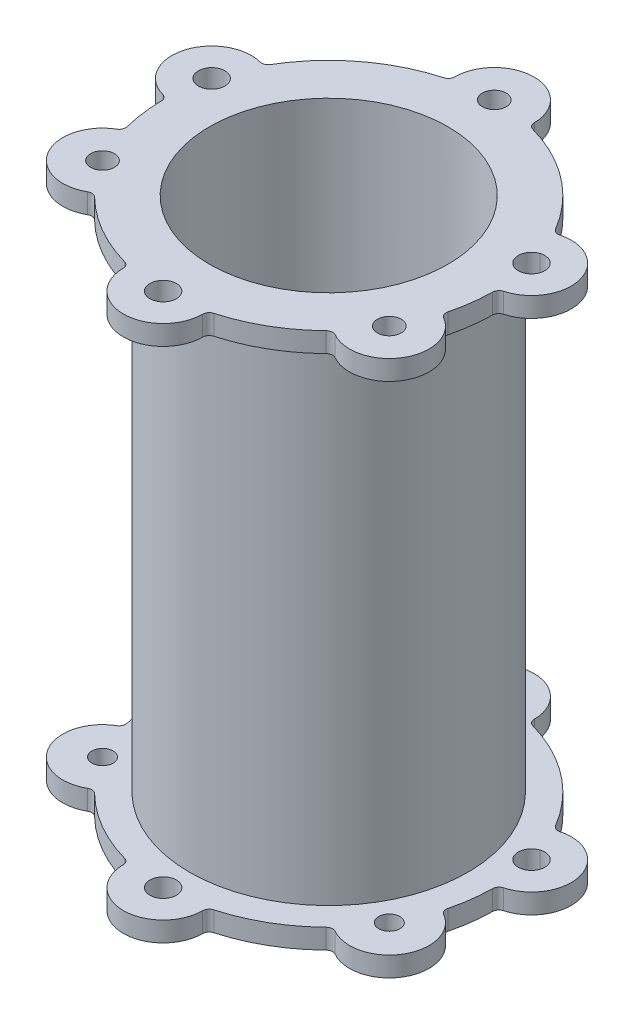
from build123d import *

# Parameters (mm, degrees)
SKETCH1_R             = 10.5
SKETCH1_R_2           = 9
BOSS_EXTRUDE1_DEPTH   = 37.5
SKETCH2_R             = 1
SKETCH2_R_2           = 9
BOSS_EXTRUDE2_DEPTH   = 1.5
FILLET1_R             = 0.5
FILLET1_OF_MIRROR1_R  = 0.5
SKETCH10_R            = 7.65
CUT_EXTRUDE1_DEPTH    = 45.592350079
SKETCH13_R            = 0.9
CUT_EXTRUDE2_DEPTH    = 1.5
M2X0_4_TAPPED_HOLE3_D = 1.6


with BuildPart() as part:
    # Sketch1 → Boss-Extrude1 (new body)
    with BuildSketch(Plane(origin=(0, 0, 0), x_dir=(1, 0, 0), z_dir=(0, 1, 0))):
        with Locations(Location((0, 0, 0), (0, 0, 270))):
            Circle(SKETCH1_R)
        with Locations(Location((0, 0, 0), (0, 0, 270))):
            Circle(SKETCH1_R_2, mode=Mode.SUBTRACT)
    extrude(amount=BOSS_EXTRUDE1_DEPTH)

    # Sketch2 → Boss-Extrude2 (add)
    with BuildSketch(Plane(origin=(0, 37.5, 0), x_dir=(1, 0, 0), z_dir=(0, 1, 0))):
        with BuildLine():
            Line((-3, -12.1346611), (-3, -12.5))
            ThreePointArc((-3, -12.5), (0, -15.5), (3, -12.5))
            Line((3, -12.5), (3, -12.1346611))
            ThreePointArc((3, -12.1346611), (6.25, -10.825317547), (9.008924778, -8.665406761))
            Line((9.008924778, -8.665406761), (9.325317547, -8.848076211))
            ThreePointArc((9.325317547, -8.848076211), (13.423393759, -7.75), (12.325317547, -3.651923789))
            Line((12.325317547, -3.651923789), (12.008924778, -3.469254338))
            ThreePointArc((12.008924778, -3.469254338), (12.393060767, -1.631577403), (12.497639685, 0.24290392))
            Line((12.497639685, 0.24290392), (12.850529964, 0.337460585))
            ThreePointArc((12.850529964, 0.337460585), (14.971850307, 4.011695199), (11.297615693, 6.133015543))
            Line((11.297615693, 6.133015543), (10.944725414, 6.038458877))
            ThreePointArc((10.944725414, 6.038458877), (7.609517863, 9.916916754), (3, 12.1346611))
            Line((3, 12.1346611), (3, 12.5))
            ThreePointArc((3, 12.5), (0, 15.5), (-3, 12.5))
            Line((-3, 12.5), (-3, 12.1346611))
            ThreePointArc((-3, 12.1346611), (-7.609517863, 9.916916754), (-10.944725414, 6.038458877))
            Line((-10.944725414, 6.038458877), (-11.297615693, 6.133015543))
            ThreePointArc((-11.297615693, 6.133015543), (-14.971850307, 4.011695199), (-12.850529964, 0.337460585))
            Line((-12.850529964, 0.337460585), (-12.497639685, 0.24290392))
            ThreePointArc((-12.497639685, 0.24290392), (-12.393060767, -1.631577403), (-12.008924778, -3.469254338))
            Line((-12.008924778, -3.469254338), (-12.325317547, -3.651923789))
            ThreePointArc((-12.325317547, -3.651923789), (-13.423393759, -7.75), (-9.325317547, -8.848076211))
            Line((-9.325317547, -8.848076211), (-9.008924778, -8.665406761))
            ThreePointArc((-9.008924778, -8.665406761), (-6.25, -10.825317547), (-3, -12.1346611))
        make_face()
        with Locations(Location((-12.074072829, 3.235238064, 0), (0, 0, 270))):
            Circle(SKETCH2_R, mode=Mode.SUBTRACT)
        with Locations(Location((0, 0, 0), (0, 0, 270))):
            Circle(SKETCH2_R_2, mode=Mode.SUBTRACT)
        with Locations((12.074072829, 3.235238064)):
            Circle(SKETCH2_R, mode=Mode.SUBTRACT)
        with Locations(Location((0, -12.5, 0), (0, 0, 270))):
            Circle(SKETCH2_R, mode=Mode.SUBTRACT)
    boss_extrude2 = extrude(amount=BOSS_EXTRUDE2_DEPTH)

    # Fillet1
    fillet1_edges = [part.edges().sort_by_distance(p)[0] for p in [
        (-3, 38.25, 12.1346611),
        (3, 38.25, 12.1346611),
        (9.008924778, 38.25, 8.665406761),
        (12.008924778, 38.25, 3.469254338),
        (12.497639685, 38.25, -0.24290392),
        (10.944725414, 38.25, -6.038458877),
        (3, 38.25, -12.1346611),
        (-3, 38.25, -12.1346611),
        (-10.944725414, 38.25, -6.038458877),
        (-12.497639685, 38.25, -0.24290392),
        (-12.008924778, 38.25, 3.469254338),
        (-9.008924778, 38.25, 8.665406761),
    ]]
    fillet(fillet1_edges, radius=FILLET1_R)

    # Mirror1: Boss-Extrude2 across plane
    add(boss_extrude2.mirror(Plane(origin=(0, 18.75, 0), x_dir=(0, 0, 1), z_dir=(0, -1, 0))))

    # Fillet1 of Mirror1
    fillet1_of_mirror1_edges = [part.edges().sort_by_distance(p)[0] for p in [
        (-3, -0.75, 12.1346611),
        (3, -0.75, 12.1346611),
        (9.008924778, -0.75, 8.665406761),
        (12.008924778, -0.75, 3.469254338),
        (12.497639685, -0.75, -0.24290392),
        (10.944725414, -0.75, -6.038458877),
        (3, -0.75, -12.1346611),
        (-3, -0.75, -12.1346611),
        (-10.944725414, -0.75, -6.038458877),
        (-12.497639685, -0.75, -0.24290392),
        (-12.008924778, -0.75, 3.469254338),
        (-9.008924778, -0.75, 8.665406761),
    ]]
    fillet(fillet1_of_mirror1_edges, radius=FILLET1_OF_MIRROR1_R)

    # Sketch10 → Cut-Extrude1 (cut, through all)
    with BuildSketch(Plane.XY):
        with Locations(Location((0, 10.55, 0), (0, 0, 90))):
            Circle(SKETCH10_R)
    extrude(amount=-CUT_EXTRUDE1_DEPTH, mode=Mode.SUBTRACT)

    # Sketch13 → Cut-Extrude2 (cut)
    with BuildSketch(Plane(origin=(0, 39, 0), x_dir=(1, 0, 0), z_dir=(0, 1, 0))):
        with Locations(Location((0, 12.5, 0), (0, 0, 270))):
            Circle(SKETCH13_R)
        with Locations(Location((-10.825317547, -6.25, 0), (0, 0, 270))):
            Circle(SKETCH13_R)
        with Locations(Location((10.825317547, -6.25, 0), (0, 0, 270))):
            Circle(SKETCH13_R)
    extrude(amount=-CUT_EXTRUDE2_DEPTH, mode=Mode.SUBTRACT)

    # M2x0.4 Tapped Hole3 (through all)
    with Locations(Plane(origin=(10.825317547, -1.5, 6.25), x_dir=(0, 0, -1), z_dir=(0, -1, 0))):
        with Locations((0, 0), (18.75, -10.825317547), (0, -21.650635094)):
            Hole(M2X0_4_TAPPED_HOLE3_D / 2)


solid = part.part
